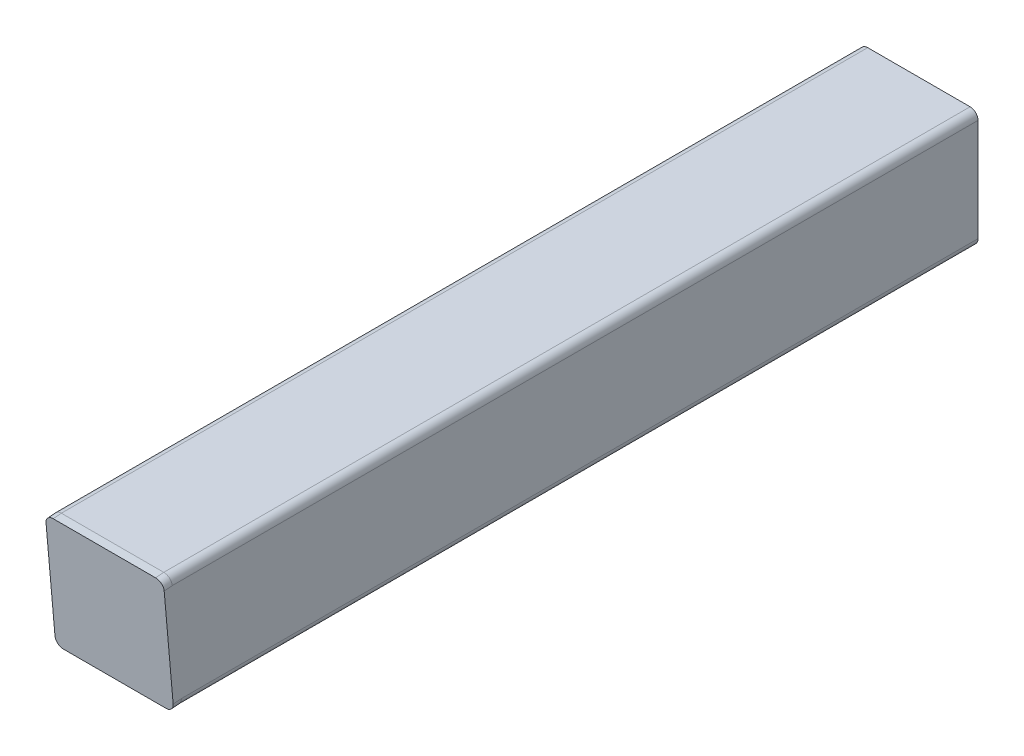
from build123d import *

# Parameters (mm, degrees)
BOSS_EXTRUDE1_DEPTH = 260
CUT_EXTRUDE1_DEPTH  = 266.524424489
BOSS_EXTRUDE2_DEPTH = 2.624382921


with BuildPart() as part:
    # Sketch1 → Boss-Extrude1 (new body)
    with BuildSketch(Plane.XY):
        with BuildLine():
            Line((2.54, 0), (35.56, 0))
            ThreePointArc((35.56, 0), (37.356051224, -0.743948776), (38.1, -2.54))
            Line((38.1, -2.54), (38.1, -35.56))
            ThreePointArc((38.1, -35.56), (37.356051224, -37.356051224), (35.56, -38.1))
            Line((35.56, -38.1), (2.54, -38.1))
            ThreePointArc((2.54, -38.1), (0.743948776, -37.356051224), (0, -35.56))
            Line((0, -35.56), (0, -2.54))
            ThreePointArc((0, -2.54), (0.743948776, -0.743948776), (2.54, 0))
        make_face()
        with BuildLine():
            Line((5.3086, -2.7686), (32.7914, -2.7686))
            ThreePointArc((32.7914, -2.7686), (34.587451224, -3.512548776), (35.3314, -5.3086))
            Line((35.3314, -5.3086), (35.3314, -32.7914))
            ThreePointArc((35.3314, -32.7914), (34.587451224, -34.587451224), (32.7914, -35.3314))
            Line((32.7914, -35.3314), (5.3086, -35.3314))
            ThreePointArc((5.3086, -35.3314), (3.512548776, -34.587451224), (2.7686, -32.7914))
            Line((2.7686, -32.7914), (2.7686, -5.3086))
            ThreePointArc((2.7686, -5.3086), (3.512548776, -3.512548776), (5.3086, -2.7686))
        make_face(mode=Mode.SUBTRACT)
    extrude(amount=BOSS_EXTRUDE1_DEPTH)

    # Sketch2 → Cut-Extrude1 (cut, through all)
    with BuildSketch(Plane(origin=(38.1, 0, 0), x_dir=(0, 0, -1), z_dir=(1, 0, 0))):
        Polygon((-260, 0), (-256.66668192, -38.1), (-260, -38.1), align=None)
    extrude(amount=-CUT_EXTRUDE1_DEPTH, mode=Mode.SUBTRACT)

    # Sketch3 → Boss-Extrude2 (add)
    with BuildSketch(Plane(origin=(0, -22.574263097, 258.025007892), x_dir=(1, 0, 0), z_dir=(0, -0.08715574274765835, 0.9961946980917457))):
        with BuildLine():
            Line((2.54, -15.585042696), (35.56, -15.585042696))
            add(Edge.make_bspline(
                [(35.56, -15.585042696), (38.1, -15.585042696), (38.1, -13.035340309)],
                knots=[0, 0, 0, 1.570796327, 1.570796327, 1.570796327], degree=2, weights=[1, 0.707106781, 1]))
            Line((38.1, -13.035340309), (38.1, 20.110790727))
            add(Edge.make_bspline(
                [(38.1, 20.110790727), (38.1, 22.660493114), (35.56, 22.660493114)],
                knots=[1.570796327, 1.570796327, 1.570796327, 3.141592654, 3.141592654, 3.141592654], degree=2, weights=[1, 0.707106781, 1]))
            Line((35.56, 22.660493114), (2.54, 22.660493114))
            add(Edge.make_bspline(
                [(2.54, 22.660493114), (0, 22.660493114), (0, 20.110790727)],
                knots=[3.141592654, 3.141592654, 3.141592654, 4.71238898, 4.71238898, 4.71238898], degree=2, weights=[1, 0.707106781, 1]))
            Line((0, 20.110790727), (0, -13.035340309))
            add(Edge.make_bspline(
                [(0, -13.035340309), (0, -15.585042696), (2.54, -15.585042696)],
                knots=[4.71238898, 4.71238898, 4.71238898, 6.283185307, 6.283185307, 6.283185307], degree=2, weights=[1, 0.707106781, 1]))
        make_face()
    extrude(amount=BOSS_EXTRUDE2_DEPTH)


solid = part.part
